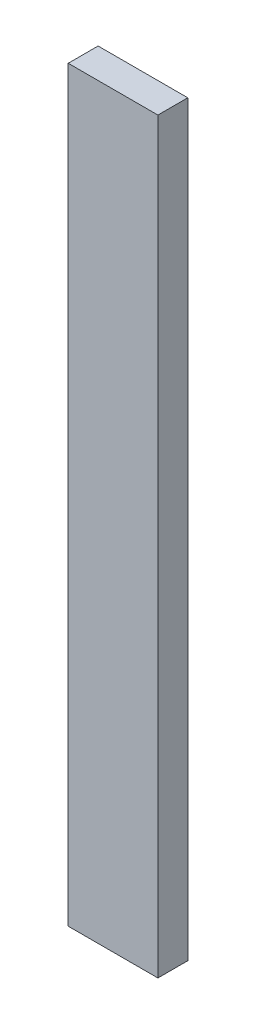
from build123d import *

# Parameters (mm, degrees)
SKETCH1_W           = 25
SKETCH1_H           = 3
BOSS_EXTRUDE1_DEPTH = 1


with BuildPart() as part:
    # Sketch1 → Boss-Extrude1 (new body)
    with BuildSketch(Plane(origin=(0, 0, 0), x_dir=(0, 1, 0), z_dir=(0, 0, 1))):
        with Locations((12.5, 1.5)):
            Rectangle(SKETCH1_W, SKETCH1_H)
    extrude(amount=BOSS_EXTRUDE1_DEPTH)


solid = part.part
